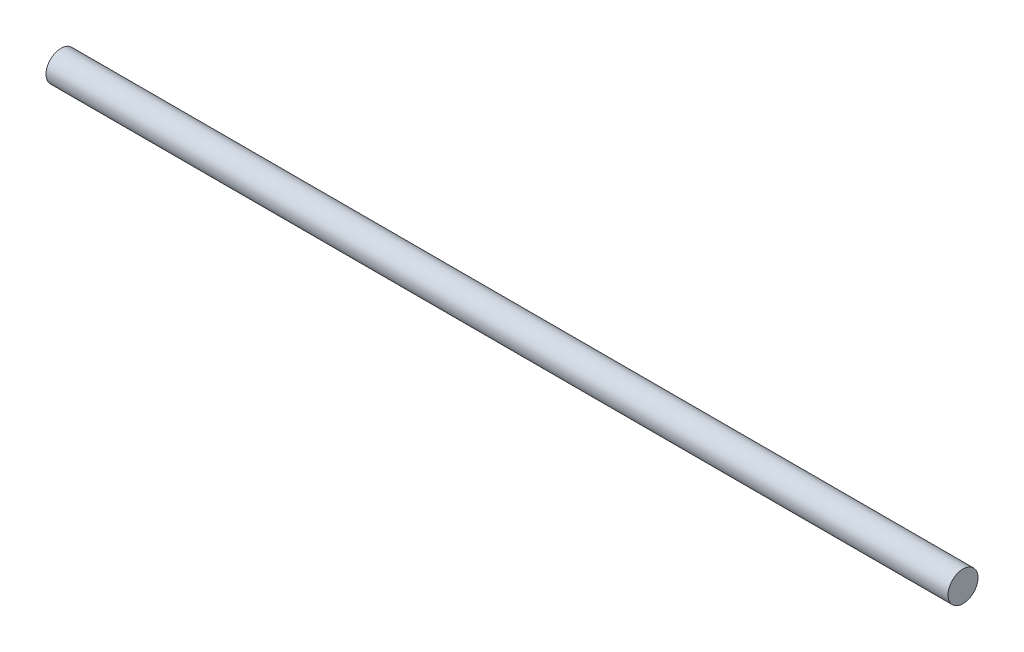
from build123d import *

# Parameters (mm, degrees)
SKETCH_1_W = 30
SKETCH_1_H = 0.5


with BuildPart() as part:
    # 草图1 → 旋转1 (revolve)
    with BuildSketch(Plane.XY, mode=Mode.PRIVATE) as revolve_1_sk:
        with Locations((15, 0.25)):
            Rectangle(SKETCH_1_W, SKETCH_1_H)
    revolve(revolve_1_sk.sketch.rotate(Axis((-126.458793885, 0, 0), (1, 0, 0)), 90), axis=Axis((-126.458793885, 0, 0), (1, 0, 0)))


solid = part.part
